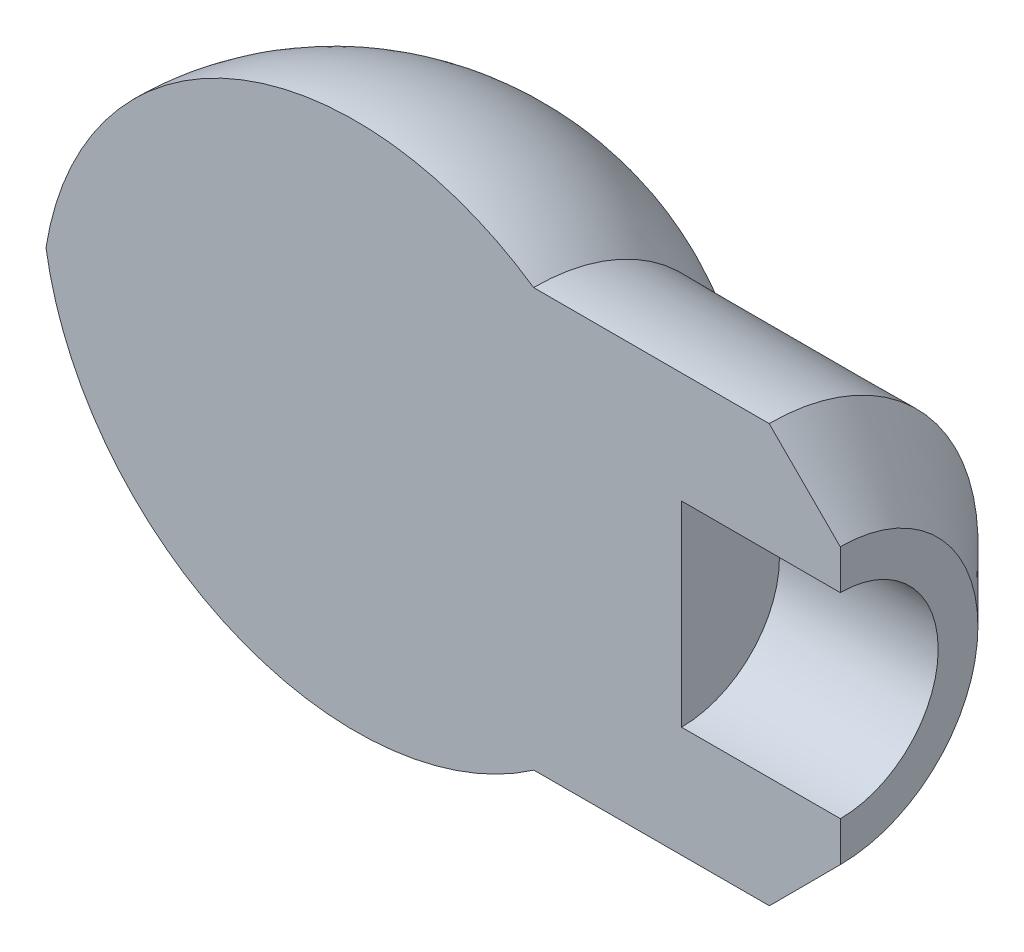
from build123d import *

# Parameters (mm, degrees)
REVOLVE1_ANGLE = 180


with BuildPart() as part:
    # Sketch2 → Revolve1 (revolve)
    with BuildSketch(Plane.XY):
        with BuildLine():
            Line((89.566728342, 37.93112192), (149.566728342, 37.93112192))
            Line((149.566728342, 37.93112192), (149.566728342, 52.93112192))
            Line((149.566728342, 52.93112192), (122.696670657, 79.801179605))
            Line((122.696670657, 79.801179605), (33.716670657, 79.801179605))
            ThreePointArc((33.716670657, 79.801179605), (-80.181557206, 91.138612278), (-150.433219191, 0.772425691))
            Line((-150.433219191, 0.772425691), (89.566728342, 0.93112192))
            Line((89.566728342, 0.93112192), (89.566728342, 37.93112192))
        make_face()
    revolve(axis=Axis((89.566728342, 0.93112192, 0), (-0.9999997813845841, -0.0006612342883058576, 0)), revolution_arc=REVOLVE1_ANGLE)


solid = part.part
